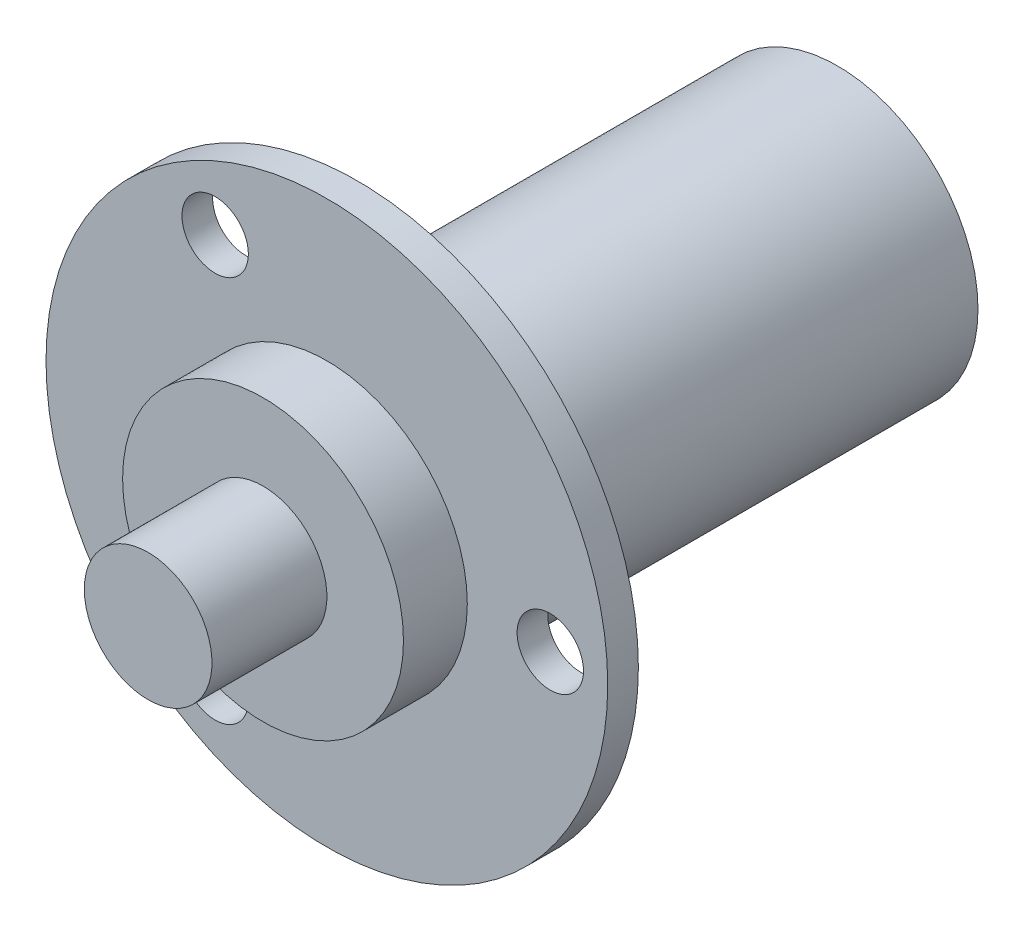
from build123d import *

# Parameters (mm, degrees)
SKETCH_2_R          = 2.6
CUT_EXTRUDE_1_DEPTH = 10


with BuildPart() as part:
    # 草图1 → 旋转1 (revolve)
    with BuildSketch(Plane(origin=(0, 0, 0), x_dir=(1, 0, 0), z_dir=(0, 1, 0))):
        Polygon((0, 0), (-5, 0), (-5, 9), (-11, 9), (-11, 14), (-22, 14), (-22, 16.4), (-11, 16.4), (-11, 54), (0, 54), align=None)
    revolve(axis=Axis((0, 0, -54), (0, 0, 1)))

    # 草图2 → 切除-拉伸1 (cut)
    with BuildSketch(Plane.XY.offset(-14)):
        with Locations((17.5, 0)):
            Circle(SKETCH_2_R)
        with Locations((-8.75, -15.155444566)):
            Circle(SKETCH_2_R)
        with Locations((-8.75, 15.155444566)):
            Circle(SKETCH_2_R)
    extrude(amount=-CUT_EXTRUDE_1_DEPTH, mode=Mode.SUBTRACT)


solid = part.part
